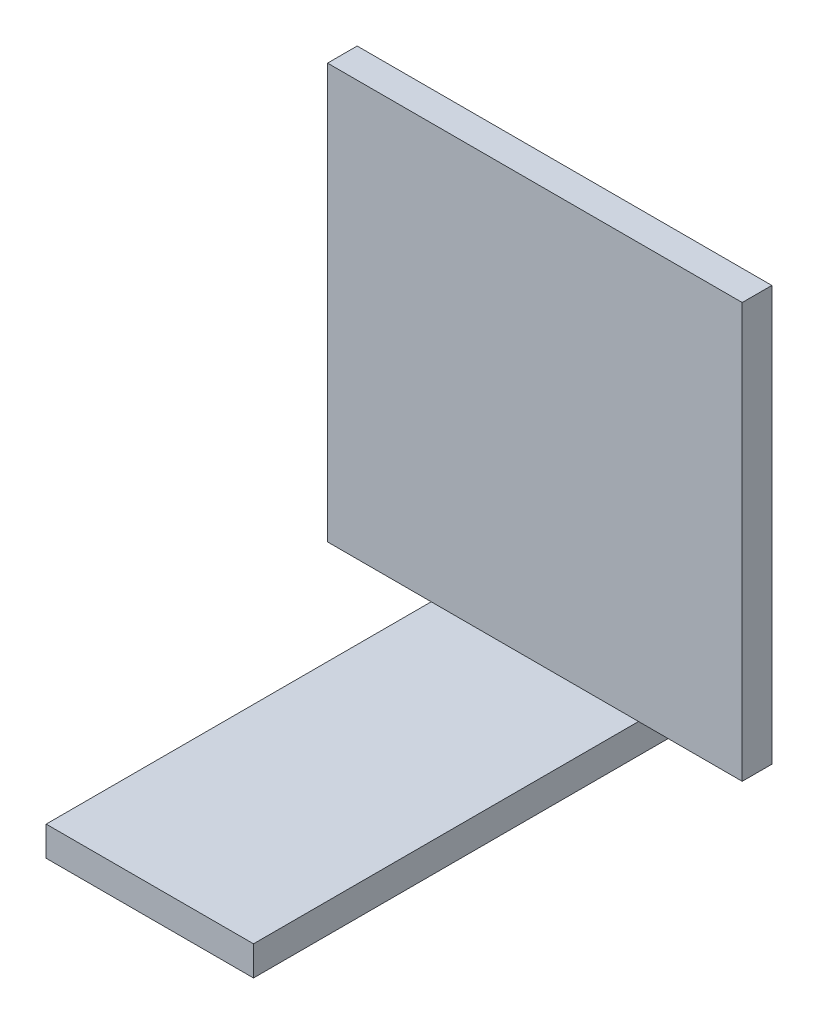
from build123d import *

# Parameters (mm, degrees)
SKETCH1_W           = 35
SKETCH1_H           = 70
BOSS_EXTRUDE1_DEPTH = 5
SKETCH2_W           = 70
SKETCH2_H           = 5
BOSS_EXTRUDE2_DEPTH = 70


with BuildPart() as part:
    # Sketch1 → Boss-Extrude1 (new body)
    with BuildSketch(Plane(origin=(0, 0, 0), x_dir=(1, 0, 0), z_dir=(0, 1, 0))):
        with Locations((17.5, 35)):
            Rectangle(SKETCH1_W, SKETCH1_H)
    extrude(amount=BOSS_EXTRUDE1_DEPTH)

    # Sketch2 → Boss-Extrude2 (add)
    with BuildSketch(Plane(origin=(0, 5, 0), x_dir=(1, 0, 0), z_dir=(0, 1, 0))):
        with Locations((17.5, 67.5)):
            Rectangle(SKETCH2_W, SKETCH2_H)
    extrude(amount=BOSS_EXTRUDE2_DEPTH)


solid = part.part
